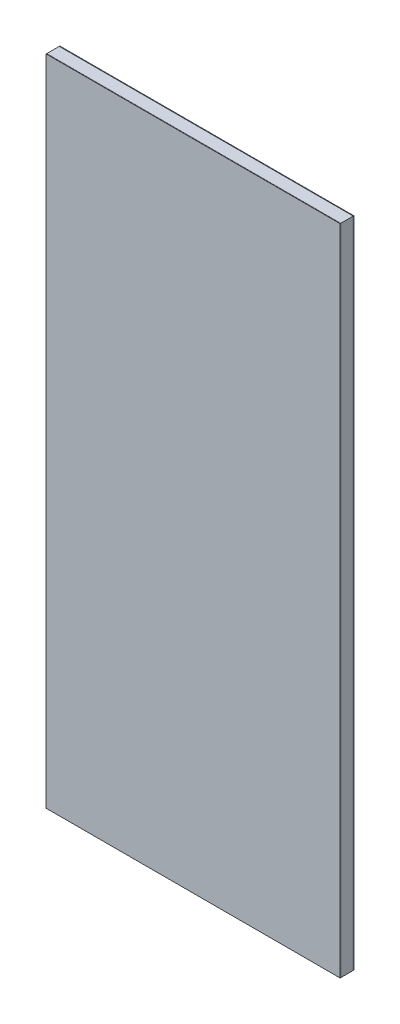
from build123d import *

# Parameters (mm, degrees)
PERFIS_PERFIL_50X40_1_DEPTH      = 2058.015621187
PERFIS_PERFIL_50X40_1_DEPTH_BACK = 58.015621187
PERFIS_PERFIL_50X40_1_2_DEPTH    = 1016.031242374
PERFIS_PERFIL_50X40_1_3_DEPTH    = 2116.031242374
PERFIS_PERFIL_50X40_1_4_DEPTH    = 1016.031242374
PERFIS_PERFIL_50X40_2_DEPTH      = 900
PERFIS_PERFIL_50X40_2_2_DEPTH    = 900
PERFIS_PERFIL_50X40_2_3_DEPTH    = 900
ESBO_O13_W                       = 900
ESBO_O13_H                       = 2000
RESSALTO_EXTRUS_O1_DEPTH         = 1
PERFIS_PERFIL_50X40_6_DEPTH      = 425
PERFIS_PERFIL_50X40_6_2_DEPTH    = 450
PERFIS_PERFIL_50X40_6_3_DEPTH    = 450
PERFIS_PERFIL_50X40_6_4_DEPTH    = 425


with BuildPart() as part:
    # Esboço11 → Perfis PERFIL_50X40(1) (new, two sides: drawn at the far end of the back side and taken through both)
    with BuildSketch(Plane(origin=(-425, -1000, 0), x_dir=(-1, 0, 0), z_dir=(0, 1, 0)).offset(-PERFIS_PERFIL_50X40_1_DEPTH_BACK)):
        with BuildLine():
            Line((-24, -20), (24, -20))
            ThreePointArc((24, -20), (24.707106781, -19.707106781), (25, -19))
            Line((25, -19), (25, 19))
            ThreePointArc((25, 19), (24.707106781, 19.707106781), (24, 20))
            Line((24, 20), (-24, 20))
            ThreePointArc((-24, 20), (-24.707106781, 19.707106781), (-25, 19))
            Line((-25, 19), (-25, -19))
            ThreePointArc((-25, -19), (-24.707106781, -19.707106781), (-24, -20))
        make_face()
        with BuildLine():
            Line((-23.4, -17.4), (-23.4, 17.4))
            ThreePointArc((-23.4, 17.4), (-23.107106781, 18.107106781), (-22.4, 18.4))
            Line((-22.4, 18.4), (22.4, 18.4))
            ThreePointArc((22.4, 18.4), (23.107106781, 18.107106781), (23.4, 17.4))
            Line((23.4, 17.4), (23.4, -17.4))
            ThreePointArc((23.4, -17.4), (23.107106781, -18.107106781), (22.4, -18.4))
            Line((22.4, -18.4), (-22.4, -18.4))
            ThreePointArc((-22.4, -18.4), (-23.107106781, -18.107106781), (-23.4, -17.4))
        make_face(mode=Mode.SUBTRACT)
    extrude(amount=PERFIS_PERFIL_50X40_1_DEPTH + PERFIS_PERFIL_50X40_1_DEPTH_BACK)

    # Perfis PERFIL_50X40(1) mitre 1
    split(bisect_by=Plane(origin=(-450, -1000, 0), x_dir=(-0.707106781, -0.707106781, 0), z_dir=(-0.707106781, 0.707106781, 0)), keep=Keep.TOP)

    # Perfis PERFIL_50X40(1) mitre 2
    split(bisect_by=Plane(origin=(-450, 1000, 0), x_dir=(0.707106781, -0.707106781, 0), z_dir=(-0.707106781, -0.707106781, 0)), keep=Keep.TOP)


with BuildPart() as body_2:
    # Esboço11 on segment 2 (carried to segment 2) → Perfis PERFIL_50X40_1 2 (new body)
    with BuildSketch(Plane(origin=(-508.015621187, 975, 0), x_dir=(0, 1, 0), z_dir=(1, 0, 0))):
        with BuildLine():
            Line((-24, -20), (24, -20))
            ThreePointArc((24, -20), (24.707106781, -19.707106781), (25, -19))
            Line((25, -19), (25, 19))
            ThreePointArc((25, 19), (24.707106781, 19.707106781), (24, 20))
            Line((24, 20), (-24, 20))
            ThreePointArc((-24, 20), (-24.707106781, 19.707106781), (-25, 19))
            Line((-25, 19), (-25, -19))
            ThreePointArc((-25, -19), (-24.707106781, -19.707106781), (-24, -20))
        make_face()
        with BuildLine():
            Line((-23.4, -17.4), (-23.4, 17.4))
            ThreePointArc((-23.4, 17.4), (-23.107106781, 18.107106781), (-22.4, 18.4))
            Line((-22.4, 18.4), (22.4, 18.4))
            ThreePointArc((22.4, 18.4), (23.107106781, 18.107106781), (23.4, 17.4))
            Line((23.4, 17.4), (23.4, -17.4))
            ThreePointArc((23.4, -17.4), (23.107106781, -18.107106781), (22.4, -18.4))
            Line((22.4, -18.4), (-22.4, -18.4))
            ThreePointArc((-22.4, -18.4), (-23.107106781, -18.107106781), (-23.4, -17.4))
        make_face(mode=Mode.SUBTRACT)
    extrude(amount=PERFIS_PERFIL_50X40_1_2_DEPTH)

    # Perfis PERFIL_50X40_1 2 mitre 1
    split(bisect_by=Plane(origin=(-450, 1000, 0), x_dir=(-0.707106781, 0.707106781, 0), z_dir=(0.707106781, 0.707106781, 0)), keep=Keep.TOP)

    # Perfis PERFIL_50X40_1 2 mitre 2
    split(bisect_by=Plane(origin=(450, 1000, 0), x_dir=(-0.707106781, -0.707106781, 0), z_dir=(-0.707106781, 0.707106781, 0)), keep=Keep.TOP)


with BuildPart() as body_3:
    # Esboço11 on segment 3 (carried to segment 3) → Perfis PERFIL_50X40_1 3 (new body)
    with BuildSketch(Plane(origin=(425, 1058.015621187, 0), x_dir=(1, 0, 0), z_dir=(0, -1, 0))):
        with BuildLine():
            Line((-24, -20), (24, -20))
            ThreePointArc((24, -20), (24.707106781, -19.707106781), (25, -19))
            Line((25, -19), (25, 19))
            ThreePointArc((25, 19), (24.707106781, 19.707106781), (24, 20))
            Line((24, 20), (-24, 20))
            ThreePointArc((-24, 20), (-24.707106781, 19.707106781), (-25, 19))
            Line((-25, 19), (-25, -19))
            ThreePointArc((-25, -19), (-24.707106781, -19.707106781), (-24, -20))
        make_face()
        with BuildLine():
            Line((-23.4, -17.4), (-23.4, 17.4))
            ThreePointArc((-23.4, 17.4), (-23.107106781, 18.107106781), (-22.4, 18.4))
            Line((-22.4, 18.4), (22.4, 18.4))
            ThreePointArc((22.4, 18.4), (23.107106781, 18.107106781), (23.4, 17.4))
            Line((23.4, 17.4), (23.4, -17.4))
            ThreePointArc((23.4, -17.4), (23.107106781, -18.107106781), (22.4, -18.4))
            Line((22.4, -18.4), (-22.4, -18.4))
            ThreePointArc((-22.4, -18.4), (-23.107106781, -18.107106781), (-23.4, -17.4))
        make_face(mode=Mode.SUBTRACT)
    extrude(amount=PERFIS_PERFIL_50X40_1_3_DEPTH)

    # Perfis PERFIL_50X40_1 3 mitre 1
    split(bisect_by=Plane(origin=(450, -1000, 0), x_dir=(-0.707106781, 0.707106781, 0), z_dir=(0.707106781, 0.707106781, 0)), keep=Keep.TOP)

    # Perfis PERFIL_50X40_1 3 mitre 2
    split(bisect_by=Plane(origin=(450, 1000, 0), x_dir=(0.707106781, 0.707106781, 0), z_dir=(0.707106781, -0.707106781, 0)), keep=Keep.TOP)


with BuildPart() as body_4:
    # Esboço11 on segment 4 (carried to segment 4) → Perfis PERFIL_50X40_1 4 (new body)
    with BuildSketch(Plane(origin=(508.015621187, -975, 0), x_dir=(0, -1, 0), z_dir=(-1, 0, 0))):
        with BuildLine():
            Line((-24, -20), (24, -20))
            ThreePointArc((24, -20), (24.707106781, -19.707106781), (25, -19))
            Line((25, -19), (25, 19))
            ThreePointArc((25, 19), (24.707106781, 19.707106781), (24, 20))
            Line((24, 20), (-24, 20))
            ThreePointArc((-24, 20), (-24.707106781, 19.707106781), (-25, 19))
            Line((-25, 19), (-25, -19))
            ThreePointArc((-25, -19), (-24.707106781, -19.707106781), (-24, -20))
        make_face()
        with BuildLine():
            Line((-23.4, -17.4), (-23.4, 17.4))
            ThreePointArc((-23.4, 17.4), (-23.107106781, 18.107106781), (-22.4, 18.4))
            Line((-22.4, 18.4), (22.4, 18.4))
            ThreePointArc((22.4, 18.4), (23.107106781, 18.107106781), (23.4, 17.4))
            Line((23.4, 17.4), (23.4, -17.4))
            ThreePointArc((23.4, -17.4), (23.107106781, -18.107106781), (22.4, -18.4))
            Line((22.4, -18.4), (-22.4, -18.4))
            ThreePointArc((-22.4, -18.4), (-23.107106781, -18.107106781), (-23.4, -17.4))
        make_face(mode=Mode.SUBTRACT)
    extrude(amount=PERFIS_PERFIL_50X40_1_4_DEPTH)

    # Perfis PERFIL_50X40_1 4 mitre 1
    split(bisect_by=Plane(origin=(-450, -1000, 0), x_dir=(0.707106781, 0.707106781, 0), z_dir=(0.707106781, -0.707106781, 0)), keep=Keep.TOP)

    # Perfis PERFIL_50X40_1 4 mitre 2
    split(bisect_by=Plane(origin=(450, -1000, 0), x_dir=(0.707106781, -0.707106781, 0), z_dir=(-0.707106781, -0.707106781, 0)), keep=Keep.TOP)


with BuildPart() as body_5:
    # Esboço12 → Perfis PERFIL_50X40(2) (new body)
    with BuildSketch(Plane(origin=(-450, -500, 0), x_dir=(0, 1, 0), z_dir=(1, 0, 0))):
        with BuildLine():
            Line((-24, -20), (24, -20))
            ThreePointArc((24, -20), (24.707106781, -19.707106781), (25, -19))
            Line((25, -19), (25, 19))
            ThreePointArc((25, 19), (24.707106781, 19.707106781), (24, 20))
            Line((24, 20), (-24, 20))
            ThreePointArc((-24, 20), (-24.707106781, 19.707106781), (-25, 19))
            Line((-25, 19), (-25, -19))
            ThreePointArc((-25, -19), (-24.707106781, -19.707106781), (-24, -20))
        make_face()
        with BuildLine():
            Line((-23.4, -17.4), (-23.4, 17.4))
            ThreePointArc((-23.4, 17.4), (-23.107106781, 18.107106781), (-22.4, 18.4))
            Line((-22.4, 18.4), (22.4, 18.4))
            ThreePointArc((22.4, 18.4), (23.107106781, 18.107106781), (23.4, 17.4))
            Line((23.4, 17.4), (23.4, -17.4))
            ThreePointArc((23.4, -17.4), (23.107106781, -18.107106781), (22.4, -18.4))
            Line((22.4, -18.4), (-22.4, -18.4))
            ThreePointArc((-22.4, -18.4), (-23.107106781, -18.107106781), (-23.4, -17.4))
        make_face(mode=Mode.SUBTRACT)
    extrude(amount=PERFIS_PERFIL_50X40_2_DEPTH)

    # Aparar/Estender1
    split(bisect_by=Plane.YZ.offset(-400), keep=Keep.TOP)

    # Aparar_Estender1 3
    split(bisect_by=Plane(origin=(400, 0, 0), x_dir=(0, -1, 0), z_dir=(-1, 0, 0)), keep=Keep.TOP)


with BuildPart() as body_6:
    # Esboço12 on segment 2 (carried to segment 2) → Perfis PERFIL_50X40_2 2 (new body)
    with BuildSketch(Plane.YZ.offset(-450)):
        with BuildLine():
            Line((-24, -20), (24, -20))
            ThreePointArc((24, -20), (24.707106781, -19.707106781), (25, -19))
            Line((25, -19), (25, 19))
            ThreePointArc((25, 19), (24.707106781, 19.707106781), (24, 20))
            Line((24, 20), (-24, 20))
            ThreePointArc((-24, 20), (-24.707106781, 19.707106781), (-25, 19))
            Line((-25, 19), (-25, -19))
            ThreePointArc((-25, -19), (-24.707106781, -19.707106781), (-24, -20))
        make_face()
        with BuildLine():
            Line((-23.4, -17.4), (-23.4, 17.4))
            ThreePointArc((-23.4, 17.4), (-23.107106781, 18.107106781), (-22.4, 18.4))
            Line((-22.4, 18.4), (22.4, 18.4))
            ThreePointArc((22.4, 18.4), (23.107106781, 18.107106781), (23.4, 17.4))
            Line((23.4, 17.4), (23.4, -17.4))
            ThreePointArc((23.4, -17.4), (23.107106781, -18.107106781), (22.4, -18.4))
            Line((22.4, -18.4), (-22.4, -18.4))
            ThreePointArc((-22.4, -18.4), (-23.107106781, -18.107106781), (-23.4, -17.4))
        make_face(mode=Mode.SUBTRACT)
    extrude(amount=PERFIS_PERFIL_50X40_2_2_DEPTH)

    # Aparar/Estender1
    split(bisect_by=Plane.YZ.offset(-400), keep=Keep.TOP)

    # Aparar_Estender1 3
    split(bisect_by=Plane(origin=(400, 0, 0), x_dir=(0, -1, 0), z_dir=(-1, 0, 0)), keep=Keep.TOP)


with BuildPart() as body_7:
    # Esboço12 on segment 3 (carried to segment 3) → Perfis PERFIL_50X40_2 3 (new body)
    with BuildSketch(Plane(origin=(-450, 500, 0), x_dir=(0, 1, 0), z_dir=(1, 0, 0))):
        with BuildLine():
            Line((-24, -20), (24, -20))
            ThreePointArc((24, -20), (24.707106781, -19.707106781), (25, -19))
            Line((25, -19), (25, 19))
            ThreePointArc((25, 19), (24.707106781, 19.707106781), (24, 20))
            Line((24, 20), (-24, 20))
            ThreePointArc((-24, 20), (-24.707106781, 19.707106781), (-25, 19))
            Line((-25, 19), (-25, -19))
            ThreePointArc((-25, -19), (-24.707106781, -19.707106781), (-24, -20))
        make_face()
        with BuildLine():
            Line((-23.4, -17.4), (-23.4, 17.4))
            ThreePointArc((-23.4, 17.4), (-23.107106781, 18.107106781), (-22.4, 18.4))
            Line((-22.4, 18.4), (22.4, 18.4))
            ThreePointArc((22.4, 18.4), (23.107106781, 18.107106781), (23.4, 17.4))
            Line((23.4, 17.4), (23.4, -17.4))
            ThreePointArc((23.4, -17.4), (23.107106781, -18.107106781), (22.4, -18.4))
            Line((22.4, -18.4), (-22.4, -18.4))
            ThreePointArc((-22.4, -18.4), (-23.107106781, -18.107106781), (-23.4, -17.4))
        make_face(mode=Mode.SUBTRACT)
    extrude(amount=PERFIS_PERFIL_50X40_2_3_DEPTH)

    # Aparar/Estender1
    split(bisect_by=Plane.YZ.offset(-400), keep=Keep.TOP)

    # Aparar_Estender1 3
    split(bisect_by=Plane(origin=(400, 0, 0), x_dir=(0, -1, 0), z_dir=(-1, 0, 0)), keep=Keep.TOP)


with BuildPart() as body_8:
    # Esboço13 → Ressalto-extrusão1 (new body)
    with BuildSketch(Plane.XY.offset(20)):
        Rectangle(ESBO_O13_W, ESBO_O13_H)
    extrude(amount=RESSALTO_EXTRUS_O1_DEPTH)


with BuildPart() as body_9:
    # Espelhar1: mirrored copy
    add(body_8.part.mirror(Plane.XY))


with BuildPart() as body_10:
    # Esboço17 → Perfis PERFIL_50X40(6) (new body)
    with BuildSketch(Plane(origin=(300, 950, 0), x_dir=(1, 0, 0), z_dir=(0, -1, 0))):
        with BuildLine():
            Line((-24, -20), (24, -20))
            ThreePointArc((24, -20), (24.707106781, -19.707106781), (25, -19))
            Line((25, -19), (25, 19))
            ThreePointArc((25, 19), (24.707106781, 19.707106781), (24, 20))
            Line((24, 20), (-24, 20))
            ThreePointArc((-24, 20), (-24.707106781, 19.707106781), (-25, 19))
            Line((-25, 19), (-25, -19))
            ThreePointArc((-25, -19), (-24.707106781, -19.707106781), (-24, -20))
        make_face()
        with BuildLine():
            Line((-23.4, -17.4), (-23.4, 17.4))
            ThreePointArc((-23.4, 17.4), (-23.107106781, 18.107106781), (-22.4, 18.4))
            Line((-22.4, 18.4), (22.4, 18.4))
            ThreePointArc((22.4, 18.4), (23.107106781, 18.107106781), (23.4, 17.4))
            Line((23.4, 17.4), (23.4, -17.4))
            ThreePointArc((23.4, -17.4), (23.107106781, -18.107106781), (22.4, -18.4))
            Line((22.4, -18.4), (-22.4, -18.4))
            ThreePointArc((-22.4, -18.4), (-23.107106781, -18.107106781), (-23.4, -17.4))
        make_face(mode=Mode.SUBTRACT)
    extrude(amount=PERFIS_PERFIL_50X40_6_DEPTH)


with BuildPart() as body_11:
    # Esboço17 on segment 2 (carried to segment 2) → Perfis PERFIL_50X40_6 2 (new body)
    with BuildSketch(Plane(origin=(300, 475, 0), x_dir=(1, 0, 0), z_dir=(0, -1, 0))):
        with BuildLine():
            Line((-24, -20), (24, -20))
            ThreePointArc((24, -20), (24.707106781, -19.707106781), (25, -19))
            Line((25, -19), (25, 19))
            ThreePointArc((25, 19), (24.707106781, 19.707106781), (24, 20))
            Line((24, 20), (-24, 20))
            ThreePointArc((-24, 20), (-24.707106781, 19.707106781), (-25, 19))
            Line((-25, 19), (-25, -19))
            ThreePointArc((-25, -19), (-24.707106781, -19.707106781), (-24, -20))
        make_face()
        with BuildLine():
            Line((-23.4, -17.4), (-23.4, 17.4))
            ThreePointArc((-23.4, 17.4), (-23.107106781, 18.107106781), (-22.4, 18.4))
            Line((-22.4, 18.4), (22.4, 18.4))
            ThreePointArc((22.4, 18.4), (23.107106781, 18.107106781), (23.4, 17.4))
            Line((23.4, 17.4), (23.4, -17.4))
            ThreePointArc((23.4, -17.4), (23.107106781, -18.107106781), (22.4, -18.4))
            Line((22.4, -18.4), (-22.4, -18.4))
            ThreePointArc((-22.4, -18.4), (-23.107106781, -18.107106781), (-23.4, -17.4))
        make_face(mode=Mode.SUBTRACT)
    extrude(amount=PERFIS_PERFIL_50X40_6_2_DEPTH)


with BuildPart() as body_12:
    # Esboço17 on segment 3 (carried to segment 3) → Perfis PERFIL_50X40_6 3 (new body)
    with BuildSketch(Plane(origin=(300, -25, 0), x_dir=(1, 0, 0), z_dir=(0, -1, 0))):
        with BuildLine():
            Line((-24, -20), (24, -20))
            ThreePointArc((24, -20), (24.707106781, -19.707106781), (25, -19))
            Line((25, -19), (25, 19))
            ThreePointArc((25, 19), (24.707106781, 19.707106781), (24, 20))
            Line((24, 20), (-24, 20))
            ThreePointArc((-24, 20), (-24.707106781, 19.707106781), (-25, 19))
            Line((-25, 19), (-25, -19))
            ThreePointArc((-25, -19), (-24.707106781, -19.707106781), (-24, -20))
        make_face()
        with BuildLine():
            Line((-23.4, -17.4), (-23.4, 17.4))
            ThreePointArc((-23.4, 17.4), (-23.107106781, 18.107106781), (-22.4, 18.4))
            Line((-22.4, 18.4), (22.4, 18.4))
            ThreePointArc((22.4, 18.4), (23.107106781, 18.107106781), (23.4, 17.4))
            Line((23.4, 17.4), (23.4, -17.4))
            ThreePointArc((23.4, -17.4), (23.107106781, -18.107106781), (22.4, -18.4))
            Line((22.4, -18.4), (-22.4, -18.4))
            ThreePointArc((-22.4, -18.4), (-23.107106781, -18.107106781), (-23.4, -17.4))
        make_face(mode=Mode.SUBTRACT)
    extrude(amount=PERFIS_PERFIL_50X40_6_3_DEPTH)


with BuildPart() as body_13:
    # Esboço17 on segment 4 (carried to segment 4) → Perfis PERFIL_50X40_6 4 (new body)
    with BuildSketch(Plane(origin=(300, -525, 0), x_dir=(1, 0, 0), z_dir=(0, -1, 0))):
        with BuildLine():
            Line((-24, -20), (24, -20))
            ThreePointArc((24, -20), (24.707106781, -19.707106781), (25, -19))
            Line((25, -19), (25, 19))
            ThreePointArc((25, 19), (24.707106781, 19.707106781), (24, 20))
            Line((24, 20), (-24, 20))
            ThreePointArc((-24, 20), (-24.707106781, 19.707106781), (-25, 19))
            Line((-25, 19), (-25, -19))
            ThreePointArc((-25, -19), (-24.707106781, -19.707106781), (-24, -20))
        make_face()
        with BuildLine():
            Line((-23.4, -17.4), (-23.4, 17.4))
            ThreePointArc((-23.4, 17.4), (-23.107106781, 18.107106781), (-22.4, 18.4))
            Line((-22.4, 18.4), (22.4, 18.4))
            ThreePointArc((22.4, 18.4), (23.107106781, 18.107106781), (23.4, 17.4))
            Line((23.4, 17.4), (23.4, -17.4))
            ThreePointArc((23.4, -17.4), (23.107106781, -18.107106781), (22.4, -18.4))
            Line((22.4, -18.4), (-22.4, -18.4))
            ThreePointArc((-22.4, -18.4), (-23.107106781, -18.107106781), (-23.4, -17.4))
        make_face(mode=Mode.SUBTRACT)
    extrude(amount=PERFIS_PERFIL_50X40_6_4_DEPTH)


solid = Compound([part.part, body_2.part, body_3.part, body_4.part, body_5.part, body_6.part, body_7.part, body_8.part, body_9.part, body_10.part, body_11.part, body_12.part, body_13.part])
